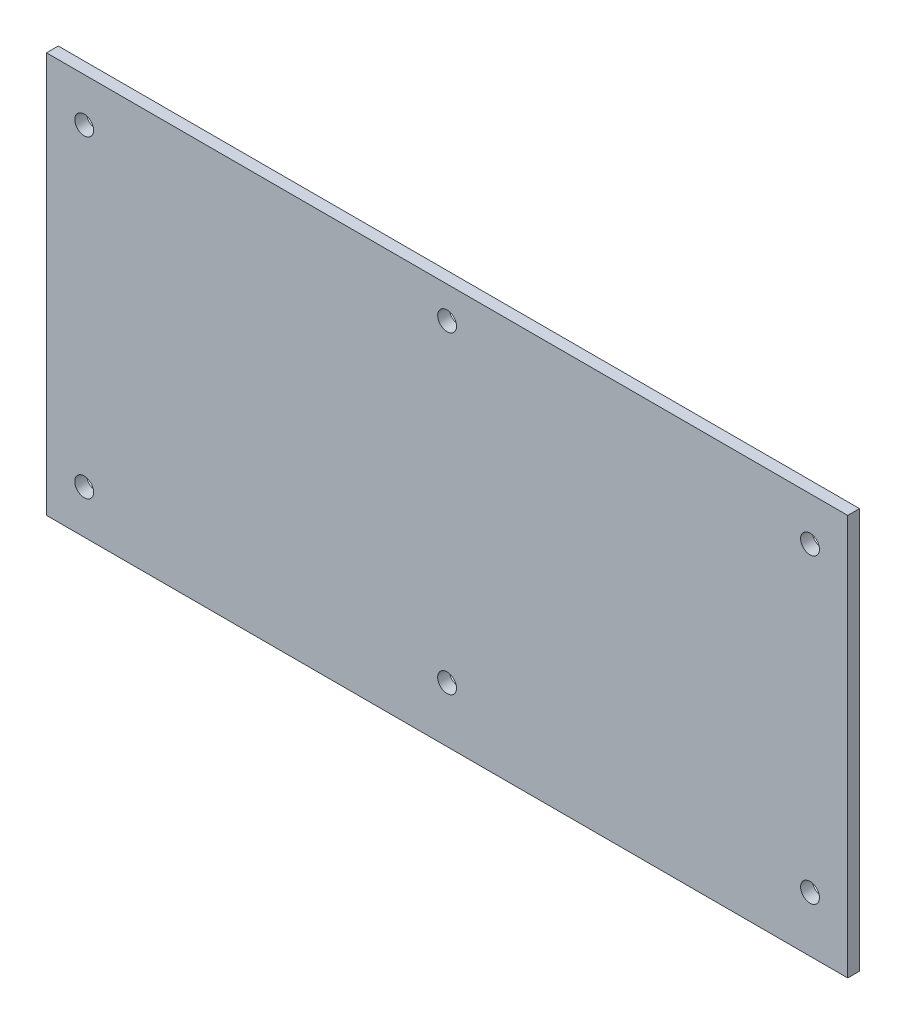
from build123d import *

# Parameters (mm, degrees)
SKETCH1_W           = 340
SKETCH1_H           = 170
SKETCH1_R           = 4
BOSS_EXTRUDE1_DEPTH = 5


with BuildPart() as part:
    # Sketch1 → Boss-Extrude1 (new body)
    with BuildSketch(Plane.XY):
        with Locations((-32.865079365, -36.765873016)):
            Rectangle(SKETCH1_W, SKETCH1_H)
        with Locations((121.134920635, 29.734126984)):
            Circle(SKETCH1_R, mode=Mode.SUBTRACT)
        with Locations((-32.865079365, 34.734126984)):
            Circle(SKETCH1_R, mode=Mode.SUBTRACT)
        with Locations((-186.865079365, 29.734126984)):
            Circle(SKETCH1_R, mode=Mode.SUBTRACT)
        with Locations((-186.865079365, -103.265873016)):
            Circle(SKETCH1_R, mode=Mode.SUBTRACT)
        with Locations((-32.865079365, -98.265873016)):
            Circle(SKETCH1_R, mode=Mode.SUBTRACT)
        with Locations((121.134920635, -98.265873016)):
            Circle(SKETCH1_R, mode=Mode.SUBTRACT)
    extrude(amount=BOSS_EXTRUDE1_DEPTH)


solid = part.part
